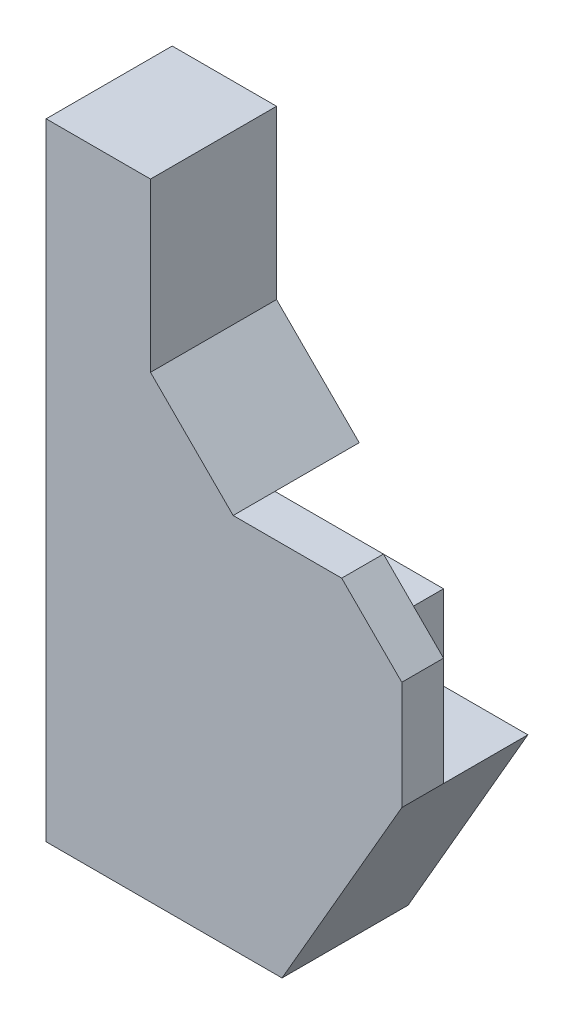
from build123d import *

# Parameters (mm, degrees)
BOSS_EXTRUDE1_DEPTH      = 10.1
BOSS_EXTRUDE1_DEPTH_BACK = 10.1
BOSS_EXTRUDE2_DEPTH      = 10


with BuildPart() as part:
    # Sketch1 → Boss-Extrude1 (new, two sides: drawn at the far end of the back side and taken through both)
    with BuildSketch(Plane.XY.offset(-BOSS_EXTRUDE1_DEPTH_BACK)):
        Polygon((0, 0), (0, 150), (25, 150), (25, 109.9), (44.8, 90.1), (5, 90.1), (5, 69.9), (65, 69.9), (65, 49.7), (85.2, 49.7), (56.505691621, 0), align=None)
        Polygon((10, 64.9), (10, 10), (50.732188929, 10), (67.879491924, 39.7), (55, 39.7), (55, 64.9), align=None, mode=Mode.SUBTRACT)
    extrude(amount=BOSS_EXTRUDE1_DEPTH + BOSS_EXTRUDE1_DEPTH_BACK)

    # Sketch2 → Boss-Extrude2 (add)
    with BuildSketch(Plane.XY.offset(10.1)):
        Polygon((44.8, 90.1), (70.8, 90.1), (85.2, 75.7), (85.2, 49.7), (56.505691621, 0), (0, 0), (0, 150), (25, 150), (25, 109.9), align=None)
    extrude(amount=BOSS_EXTRUDE2_DEPTH)


solid = part.part
